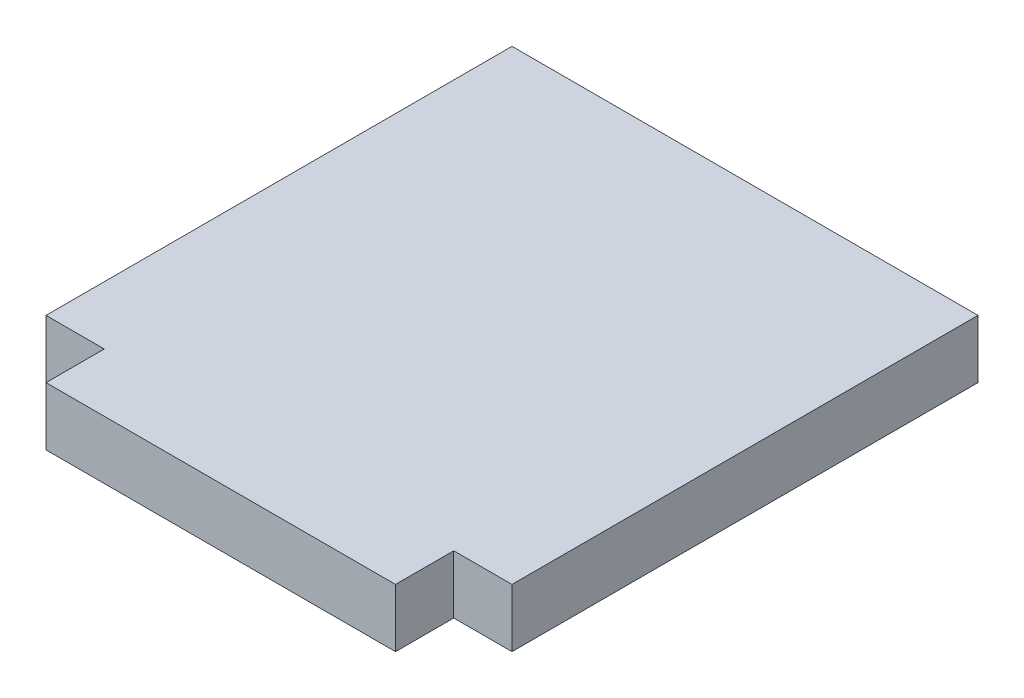
from build123d import *

# Parameters (mm, degrees)
SALIENTE_EXTRUIR1_DEPTH = 3


with BuildPart() as part:
    # Croquis1 → Saliente-Extruir1 (new body)
    with BuildSketch(Plane(origin=(0, 0, 0), x_dir=(1, 0, 0), z_dir=(0, 1, 0))):
        Polygon((0, 3), (0, 0), (18, 0), (18, 3), (21, 3), (21, 27), (18, 27), (0, 27), (-3, 27), (-3, 3), align=None)
    extrude(amount=SALIENTE_EXTRUIR1_DEPTH)


solid = part.part
